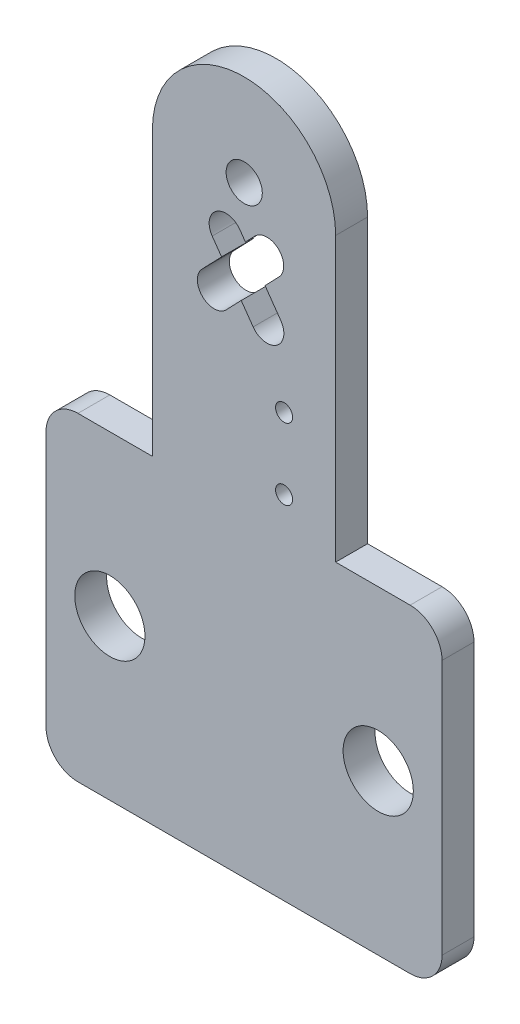
from build123d import *

# Parameters (mm, degrees)
BOSS_EXTRUDE1_DEPTH     = 3
M3_CLEARANCE_HOLE1_D    = 3.4
M6_CLEARANCE_HOLE1_D    = 6.6
FILLET1_R               = 3
CUT_EXTRUDE1_DEPTH      = 10
TAP_DRILL_FOR_M2_TAP1_D = 1.6


with BuildPart() as part:
    # Sketch1 → Boss-Extrude1 (new body)
    with BuildSketch(Plane.XY):
        with BuildLine():
            Line((50.773782993, 15), (50.773782993, 41.5958))
            ThreePointArc((50.773782993, 41.5958), (59.386891497, 50.208908503), (68, 41.5958))
            Line((68, 41.5958), (68, 15))
            Line((68, 15), (78, 15))
            Line((78, 15), (78, -15))
            Line((78, -15), (40.773782993, -15))
            Line((40.773782993, -15), (40.773782993, 15))
            Line((40.773782993, 15), (50.773782993, 15))
        make_face()
    extrude(amount=BOSS_EXTRUDE1_DEPTH)

    # M3 Clearance Hole1 (through all)
    with Locations(Plane.XY.offset(3)):
        with Locations((59.40350934, 41.5958)):
            Hole(M3_CLEARANCE_HOLE1_D / 2)

    # M6 Clearance Hole1 (through all)
    with Locations(Plane.XY.offset(3)):
        with Locations((46.773782993, 0), (72, 0)):
            Hole(M6_CLEARANCE_HOLE1_D / 2)

    # Fillet1
    fillet1_edges = [part.edges().sort_by_distance(p)[0] for p in [
        (78, -15, 1.5),
        (40.773782993, -15, 1.5),
        (40.773782993, 15, 1.5),
        (78, 15, 1.5),
    ]]
    fillet(fillet1_edges, radius=FILLET1_R)

    # Sketch6 → Cut-Extrude1 (cut)
    with BuildSketch(Plane(origin=(0, 0, 0), x_dir=(-1, 0, 0), z_dir=(0, 0, -1))):
        with BuildLine():
            Line((-59.121027546, 31.863253301), (-60.242174181, 30.268733642))
            ThreePointArc((-60.242174181, 30.268733642), (-62.453888564, 29.883205447), (-62.839416759, 32.09491983))
            Line((-62.839416759, 32.09491983), (-61.362577576, 34.195313335))
            Line((-61.362577576, 34.195313335), (-62.6763448, 35.562128261))
            ThreePointArc((-62.6763448, 35.562128261), (-62.63227279, 37.789154911), (-60.40524614, 37.7450829))
            Line((-60.40524614, 37.7450829), (-59.516660479, 36.820617651))
            Line((-59.516660479, 36.820617651), (-58.992072259, 37.566698674))
            ThreePointArc((-58.992072259, 37.566698674), (-56.780357876, 37.952226869), (-56.394829681, 35.740512487))
            Line((-56.394829681, 35.740512487), (-57.275110449, 34.488557618))
            Line((-57.275110449, 34.488557618), (-55.440588029, 32.579960282))
            ThreePointArc((-55.440588029, 32.579960282), (-55.484660039, 30.352933632), (-57.71168669, 30.397005642))
            Line((-57.71168669, 30.397005642), (-59.121027546, 31.863253301))
        make_face()
    extrude(amount=-CUT_EXTRUDE1_DEPTH, mode=Mode.SUBTRACT)

    # Tap Drill for M2 Tap1 (through all)
    with Locations(Plane.XY.offset(3)):
        with Locations((63.15, 24.765), (63.15, 18.065)):
            Hole(TAP_DRILL_FOR_M2_TAP1_D / 2)


solid = part.part
